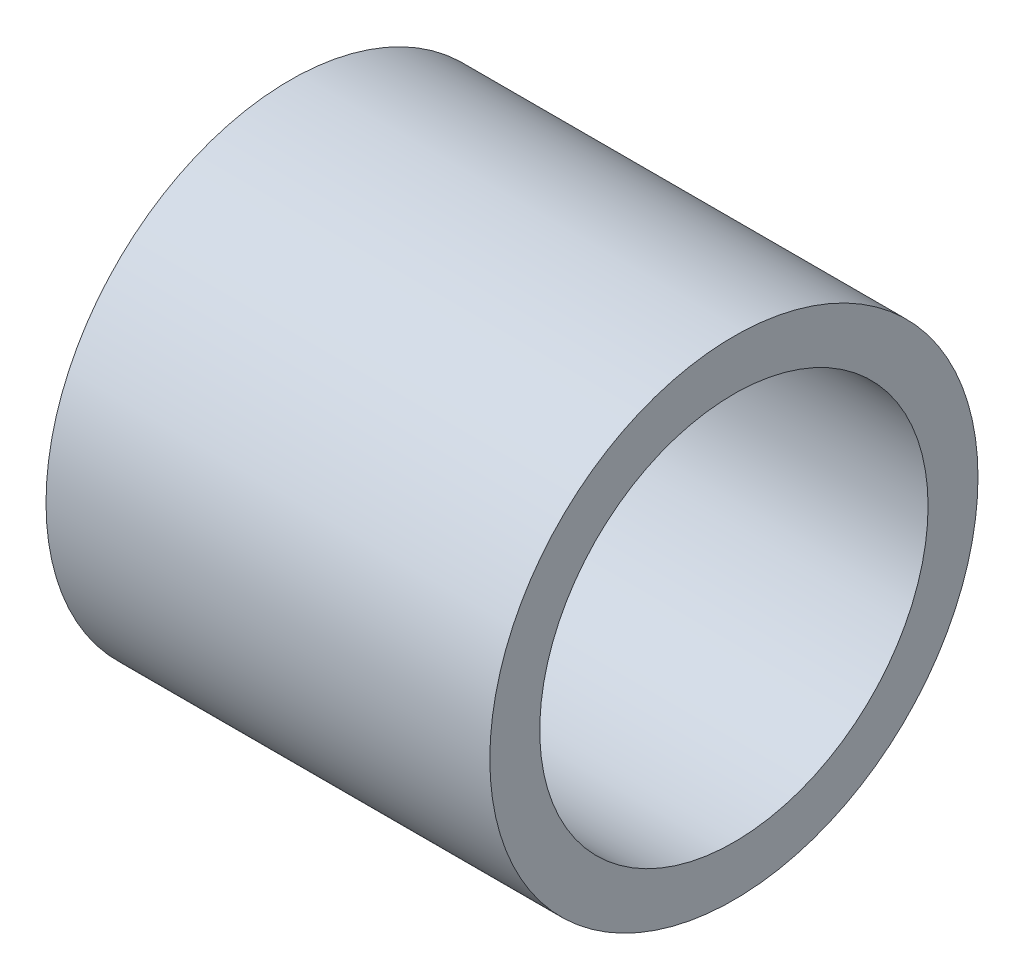
from build123d import *

# Parameters (mm, degrees)
SKETCH1_R      = 11
SKETCH1_R_2    = 8.75
EXTRUDE1_DEPTH = 20


with BuildPart() as part:
    # Sketch1 → Extrude1 (new body)
    with BuildSketch(Plane(origin=(0, 0, 0), x_dir=(0, 0, -1), z_dir=(1, 0, 0))):
        Circle(SKETCH1_R)
        Circle(SKETCH1_R_2, mode=Mode.SUBTRACT)
    extrude(amount=EXTRUDE1_DEPTH)


solid = part.part
